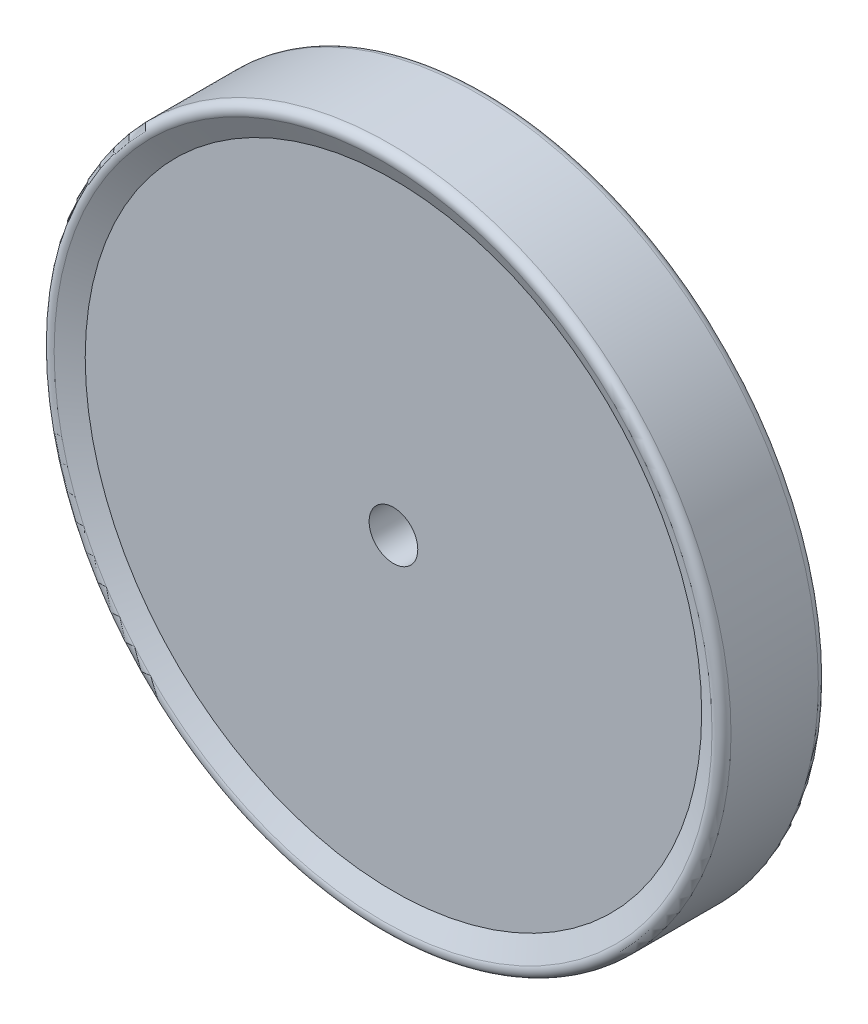
from build123d import *

# Parameters (mm, degrees)
SKETCH1_R           = 19
SKETCH1_R_2         = 1.5
BOSS_EXTRUDE1_DEPTH = 5
FILLET1_R           = 0.5


with BuildPart() as part:
    # Sketch1 → Boss-Extrude1 (new body)
    with BuildSketch(Plane.XY):
        Circle(SKETCH1_R)
        Circle(SKETCH1_R_2, mode=Mode.SUBTRACT)
    extrude(amount=BOSS_EXTRUDE1_DEPTH)


with BuildPart() as body_2:
    # Sketch2 → Revolve2 (revolve)
    with BuildSketch(Plane(origin=(0, 0, 0), x_dir=(1, 0, 0), z_dir=(0, 1, 0)), mode=Mode.PRIVATE) as revolve2_sk:
        Polygon((21, -6), (21, 1), (19, 0), (19, -5), align=None)
    revolve(revolve2_sk.sketch.rotate(Axis((0, 0, 0), (0, 0, 1)), 180), axis=Axis((0, 0, 0), (0, 0, 1)))

    # Fillet1
    fillet1_edges = [body_2.edges().sort_by_distance(p)[0] for p in [
        (21, 0, -1),
        (21, 0, 6),
    ]]
    fillet(fillet1_edges, radius=FILLET1_R)


solid = Compound([part.part, body_2.part])
